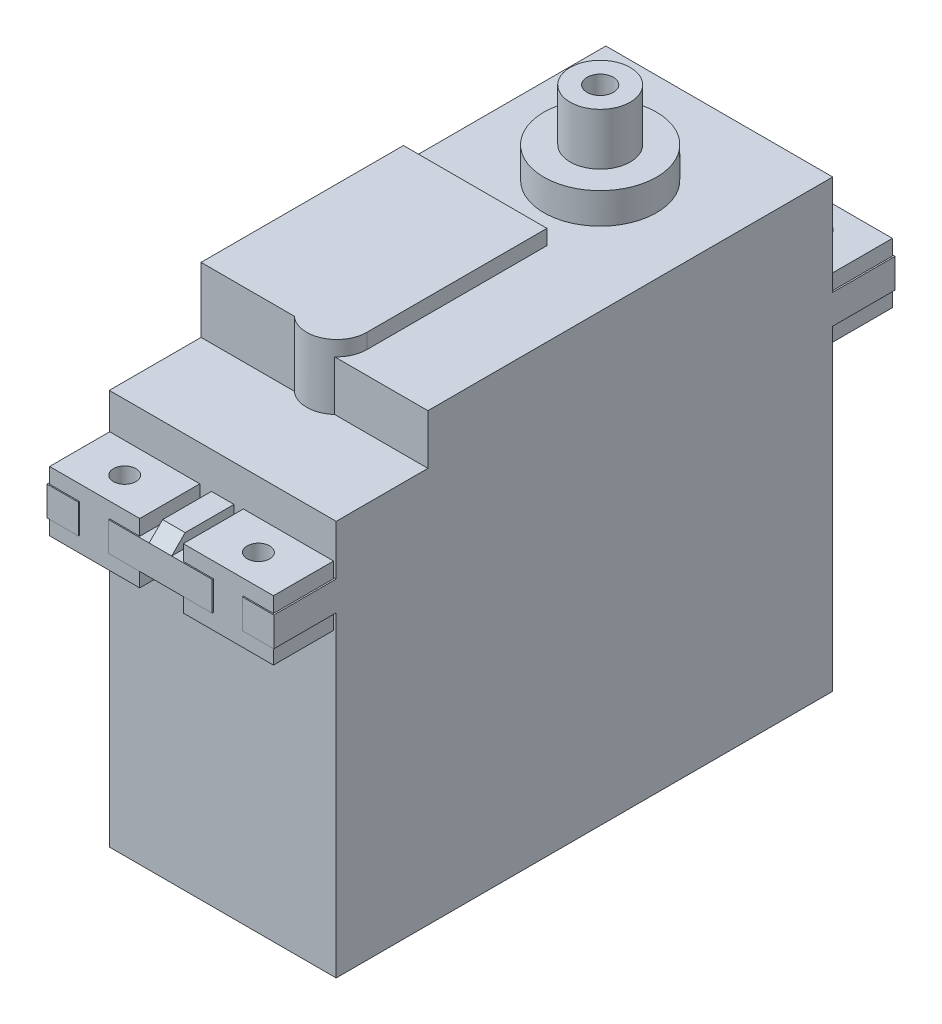
from build123d import *

# Parameters (mm, degrees)
BOSS_EXTRUDE1_DEPTH  = 30.2
CUT_EXTRUDE3_DEPTH   = 6.9
SKETCH10_R           = 7.5
BOSS_EXTRUDE6_DEPTH  = 4.1
SKETCH11_R           = 4
BOSS_EXTRUDE7_DEPTH  = 6.9
BOSS_EXTRUDE8_DEPTH  = 8.9
BOSS_EXTRUDE9_DEPTH  = 2
BOSS_EXTRUDE10_DEPTH = 1.8
CUT_EXTRUDE5_DEPTH   = 4
SKETCH23_R           = 1.75
CUT_EXTRUDE6_DEPTH   = 7
ESQUISSE1_W          = 7
ESQUISSE1_H          = 4
BOSS_EXTRU_1_DEPTH   = 7
BOSS_EXTRU_1_TAPER   = 5
BOSS_EXTRU_2_START   = 2.05
ESQUISSE2_W          = 12
ESQUISSE2_H          = 8
ESQUISSE2_R          = 1.5
BOSS_EXTRU_2_DEPTH   = 8
BOSS_EXTRU_2_2_DEPTH = 8
BOSS_EXTRU_2_3_DEPTH = 8
BOSS_EXTRU_2_4_DEPTH = 8


with BuildPart() as part:
    # Sketch1 → Boss-Extrude1 (new body)
    with BuildSketch(Plane(origin=(0, 0, 0), x_dir=(0, 0, -1), z_dir=(1, 0, 0))):
        Polygon((0, 0), (66.1, 0), (66.1, 42.1), (74.4, 42.1), (74.4, 46), (66.1, 46), (66.1, 59.3), (12.213560369, 59.3), (12.213560369, 52.65), (0, 52.65), (0, 46), (-8.3, 46), (-8.3, 42.1), (0, 42.1), align=None)
    extrude(amount=BOSS_EXTRUDE1_DEPTH)

    # Sketch9 → Cut-Extrude3 (cut)
    with BuildSketch(Plane(origin=(0, 46, 0), x_dir=(1, 0, 0), z_dir=(0, 1, 0))):
        with BuildLine():
            Line((22, 74.4), (22, 72.137458609))
            ThreePointArc((22, 72.137458609), (24, 67.5), (26, 72.137458609))
            Line((26, 72.137458609), (26, 74.4))
            Line((26, 74.4), (24, 74.4))
            Line((24, 74.4), (22, 74.4))
        make_face()
        with BuildLine():
            Line((6.2, 74.4), (4.2, 74.4))
            Line((4.2, 74.4), (4.2, 72.137458609))
            ThreePointArc((4.2, 72.137458609), (6.2, 67.5), (8.2, 72.137458609))
            Line((8.2, 72.137458609), (8.2, 74.4))
            Line((8.2, 74.4), (6.2, 74.4))
        make_face()
        with BuildLine():
            Line((24, -8.3), (26, -8.3))
            Line((26, -8.3), (26, -6.037458609))
            ThreePointArc((26, -6.037458609), (24, -1.4), (22, -6.037458609))
            Line((22, -6.037458609), (22, -8.3))
            Line((22, -8.3), (24, -8.3))
        make_face()
        with BuildLine():
            Line((8.2, -8.3), (8.2, -6.037458609))
            ThreePointArc((8.2, -6.037458609), (6.2, -1.4), (4.2, -6.037458609))
            Line((4.2, -6.037458609), (4.2, -8.3))
            Line((4.2, -8.3), (6.2, -8.3))
            Line((6.2, -8.3), (8.2, -8.3))
        make_face()
    extrude(amount=-CUT_EXTRUDE3_DEPTH, mode=Mode.SUBTRACT)

    # Sketch10 → Boss-Extrude6 (add)
    with BuildSketch(Plane(origin=(0, 59.3, 0), x_dir=(1, 0, 0), z_dir=(0, 1, 0))):
        with Locations(Location((15.1, 50.25, 0), (0, 0, 90))):
            Circle(SKETCH10_R)
    extrude(amount=BOSS_EXTRUDE6_DEPTH)

    # Sketch11 → Boss-Extrude7 (add)
    with BuildSketch(Plane(origin=(0, 63.4, 0), x_dir=(1, 0, 0), z_dir=(0, 1, 0))):
        with Locations(Location((15.1, 50.25, 0), (0, 0, 90))):
            Circle(SKETCH11_R)
    extrude(amount=BOSS_EXTRUDE7_DEPTH)

    # Sketch14 → Boss-Extrude8 (add)
    with BuildSketch(Plane(origin=(0, 61.3, 0), x_dir=(1, 0, 0), z_dir=(0, 1, 0))):
        with BuildLine():
            Line((0, 39.156780185), (15.1, 39.156780185))
            Line((15.1, 39.156780185), (19.1, 39.156780185))
            Line((19.1, 39.156780185), (19.1, 15.178872415))
            ThreePointArc((19.1, 15.178872415), (15.1, 11.178872415), (11.1, 15.178872415))
            Line((11.1, 15.178872415), (0, 15.178872415))
            Line((0, 15.178872415), (0, 39.156780185))
        make_face()
    extrude(amount=-BOSS_EXTRUDE8_DEPTH)

    # Sketch17 → Boss-Extrude9 (add)
    with BuildSketch(Plane(origin=(0, 59.3, 0), x_dir=(1, 0, 0), z_dir=(0, 1, 0))):
        Polygon((0, 12.213560369), (15.153721143, 12.213560369), (15.1, 15.178872415), (0, 15.178872415), align=None)
    extrude(amount=BOSS_EXTRUDE9_DEPTH)

    # Sketch18 → Boss-Extrude10 (add)
    with BuildSketch(Plane(origin=(0, 46, 0), x_dir=(1, 0, 0), z_dir=(0, 1, 0))):
        Polygon((15.1, 74.4), (16.6, 74.4), (16.6, 66.1), (13.6, 66.1), (13.6, 74.4), align=None)
        Polygon((13.6, -8.3), (15.1, -8.3), (16.6, -8.3), (16.6, 0), (13.6, 0), align=None)
    extrude(amount=BOSS_EXTRUDE10_DEPTH)

    # Sketch22 → Cut-Extrude5 (cut)
    with BuildSketch(Plane(origin=(16.6, 0, 0), x_dir=(0, 0, -1), z_dir=(1, 0, 0))):
        Polygon((74.4, 46), (72.6, 47.8), (74.4, 47.8), align=None)
        Polygon((-8.3, 47.8), (-8.3, 46), (-6.5, 47.8), align=None)
    extrude(amount=-CUT_EXTRUDE5_DEPTH, mode=Mode.SUBTRACT)

    # Sketch23 → Cut-Extrude6 (cut)
    with BuildSketch(Plane(origin=(0, 70.3, 0), x_dir=(1, 0, 0), z_dir=(0, 1, 0))):
        with Locations(Location((15.1, 50.25, 0), (0, 0, 270))):
            Circle(SKETCH23_R)
    extrude(amount=-CUT_EXTRUDE6_DEPTH, mode=Mode.SUBTRACT)

    # Esquisse1 → Boss.-Extru.1 (add)
    with BuildSketch(Plane(origin=(0, 0, -66.1), x_dir=(-1, 0, 0), z_dir=(0, 0, -1))):
        with Locations((-15.1, 5)):
            Rectangle(ESQUISSE1_W, ESQUISSE1_H)
    extrude(amount=BOSS_EXTRU_1_DEPTH, taper=BOSS_EXTRU_1_TAPER)


with BuildPart() as body_2:
    # Esquisse2 → Boss.-Extru.2 (new body)
    with BuildSketch(Plane(origin=(0, 46, 0), x_dir=(1, 0, 0), z_dir=(0, 1, 0)).offset(BOSS_EXTRU_2_START)):
        with Locations((6.2, -4.15)):
            Rectangle(ESQUISSE2_W, ESQUISSE2_H)
        with Locations(Location((6.2, -4.15, 0), (0, 0, 270))):
            Circle(ESQUISSE2_R, mode=Mode.SUBTRACT)
    extrude(amount=-BOSS_EXTRU_2_DEPTH)


with BuildPart() as body_3:
    # Esquisse2 → Boss.-Extru.2 2 (new body)
    with BuildSketch(Plane(origin=(0, 46, 0), x_dir=(1, 0, 0), z_dir=(0, 1, 0)).offset(BOSS_EXTRU_2_START)):
        with Locations((24, -4.15)):
            Rectangle(ESQUISSE2_W, ESQUISSE2_H)
        with Locations(Location((24, -4.15, 0), (0, 0, 90))):
            Circle(ESQUISSE2_R, mode=Mode.SUBTRACT)
    extrude(amount=-BOSS_EXTRU_2_2_DEPTH)


with BuildPart() as body_4:
    # Esquisse2 → Boss.-Extru.2 3 (new body)
    with BuildSketch(Plane(origin=(0, 46, 0), x_dir=(1, 0, 0), z_dir=(0, 1, 0)).offset(BOSS_EXTRU_2_START)):
        with Locations((24, 70.25)):
            Rectangle(ESQUISSE2_W, ESQUISSE2_H)
        with Locations(Location((24, 70.25, 0), (0, 0, 270))):
            Circle(ESQUISSE2_R, mode=Mode.SUBTRACT)
    extrude(amount=-BOSS_EXTRU_2_3_DEPTH)


with BuildPart() as body_5:
    # Esquisse2 → Boss.-Extru.2 4 (new body)
    with BuildSketch(Plane(origin=(0, 46, 0), x_dir=(1, 0, 0), z_dir=(0, 1, 0)).offset(BOSS_EXTRU_2_START)):
        with Locations((6.2, 70.25)):
            Rectangle(ESQUISSE2_W, ESQUISSE2_H)
        with Locations(Location((6.2, 70.25, 0), (0, 0, 90))):
            Circle(ESQUISSE2_R, mode=Mode.SUBTRACT)
    extrude(amount=-BOSS_EXTRU_2_4_DEPTH)


solid = Compound([part.part, body_2.part, body_3.part, body_4.part, body_5.part])
